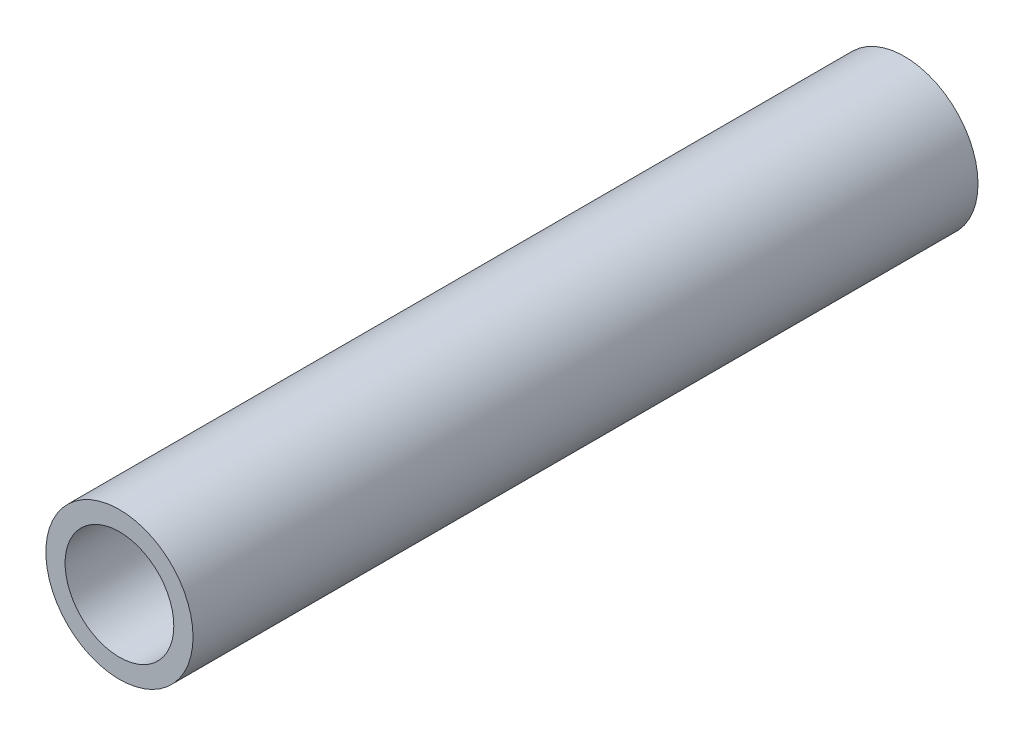
from build123d import *

# Parameters (mm, degrees)
SKETCH2_R           = 4.7625
SKETCH2_R_2         = 3.5179
BOSS_EXTRUDE1_DEPTH = 50.8


with BuildPart() as part:
    # Sketch2 → Boss-Extrude1 (new body)
    with BuildSketch(Plane.XY):
        Circle(SKETCH2_R)
        Circle(SKETCH2_R_2, mode=Mode.SUBTRACT)
    extrude(amount=BOSS_EXTRUDE1_DEPTH)


solid = part.part
